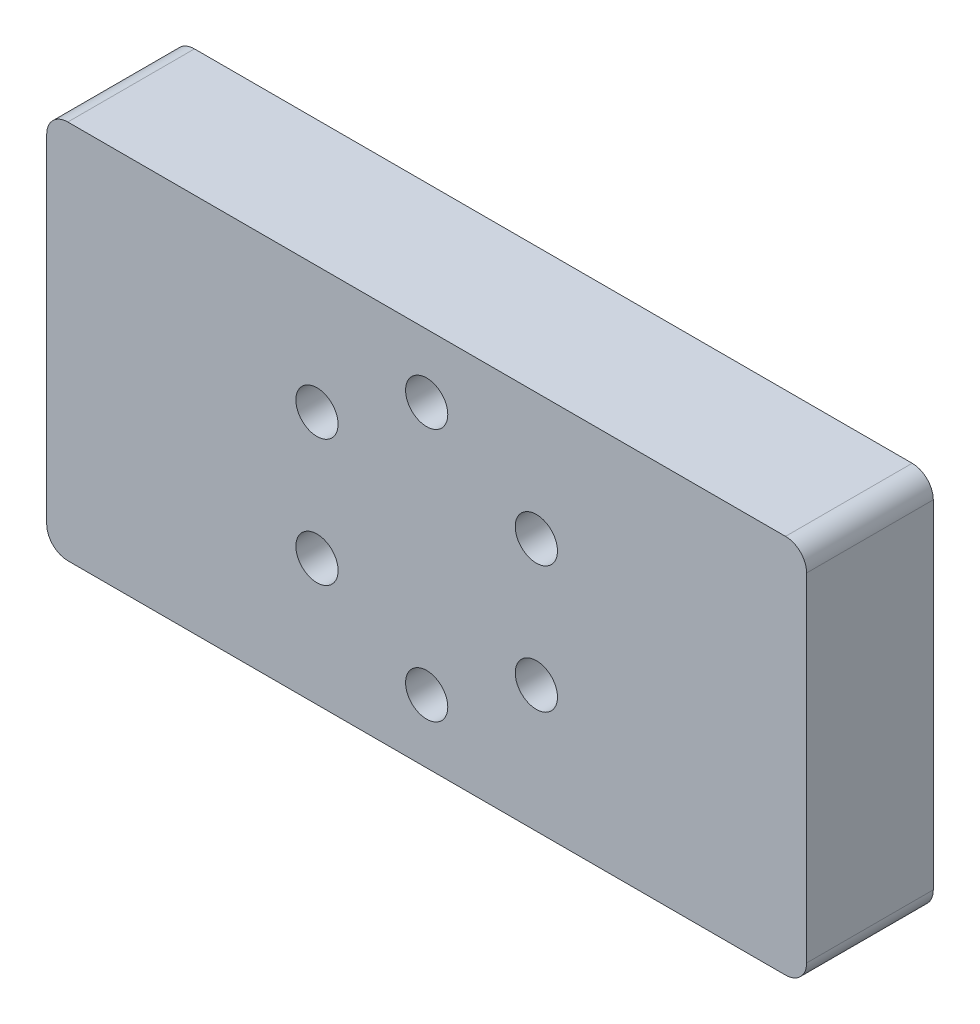
from build123d import *

# Parameters (mm, degrees)
RESSALTO_EXTRUS_O1_DEPTH = 30
ESBO_O2_R                = 5
CORTE_EXTRUS_O1_DEPTH    = 30


with BuildPart() as part:
    # Esboço1 → Ressalto-extrusão1 (new body)
    with BuildSketch(Plane.XY):
        with BuildLine():
            Line((-85, -45), (85, -45))
            ThreePointArc((85, -45), (88.535533906, -43.535533906), (90, -40))
            Line((90, -40), (90, 40))
            ThreePointArc((90, 40), (88.535533906, 43.535533906), (85, 45))
            Line((85, 45), (-85, 45))
            ThreePointArc((-85, 45), (-88.535533906, 43.535533906), (-90, 40))
            Line((-90, 40), (-90, -40))
            ThreePointArc((-90, -40), (-88.535533906, -43.535533906), (-85, -45))
        make_face()
    extrude(amount=RESSALTO_EXTRUS_O1_DEPTH)

    # Esboço2 → Corte-extrusão1 (cut)
    with BuildSketch(Plane.XY.offset(30)):
        with Locations((0, 30)):
            Circle(ESBO_O2_R)
        with Locations((25.980762114, 15)):
            Circle(ESBO_O2_R)
        with Locations((25.980762114, -15)):
            Circle(ESBO_O2_R)
        with Locations((0, -30)):
            Circle(ESBO_O2_R)
        with Locations((-25.980762114, -15)):
            Circle(ESBO_O2_R)
        with Locations((-25.980762114, 15)):
            Circle(ESBO_O2_R)
    extrude(amount=-CORTE_EXTRUS_O1_DEPTH, mode=Mode.SUBTRACT)


solid = part.part
